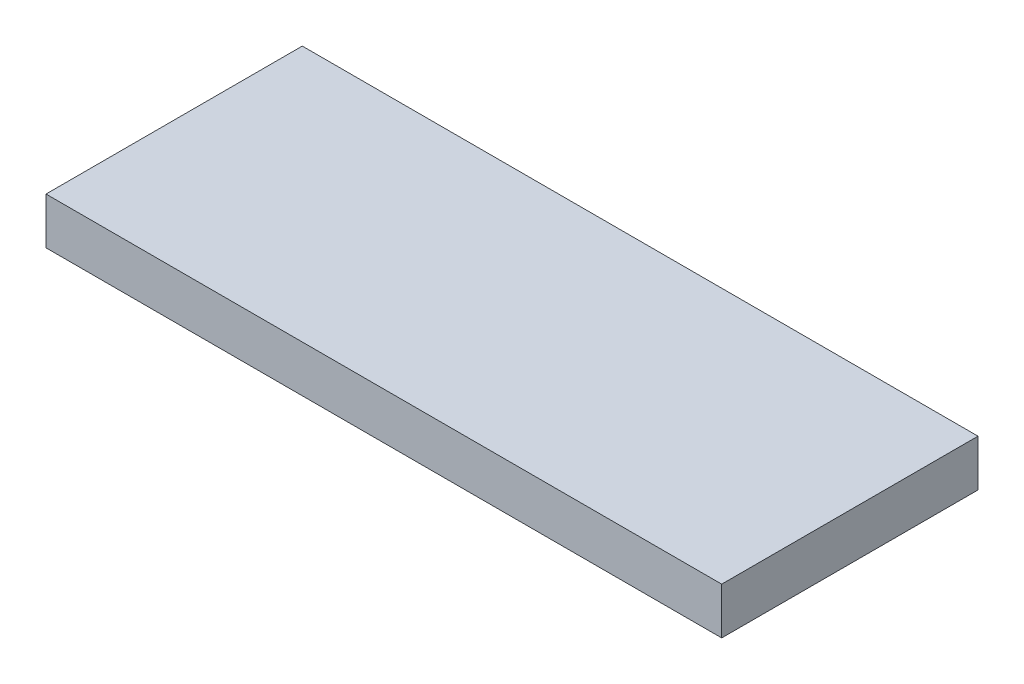
from build123d import *

# Parameters (mm, degrees)
SKETCH1_W           = 368.3
SKETCH1_H           = 139.7
BOSS_EXTRUDE1_DEPTH = 25.4


with BuildPart() as part:
    # Sketch1 → Boss-Extrude1 (new body)
    with BuildSketch(Plane(origin=(0, 0, 0), x_dir=(1, 0, 0), z_dir=(0, 1, 0))):
        Rectangle(SKETCH1_W, SKETCH1_H)
    extrude(amount=BOSS_EXTRUDE1_DEPTH)


solid = part.part
